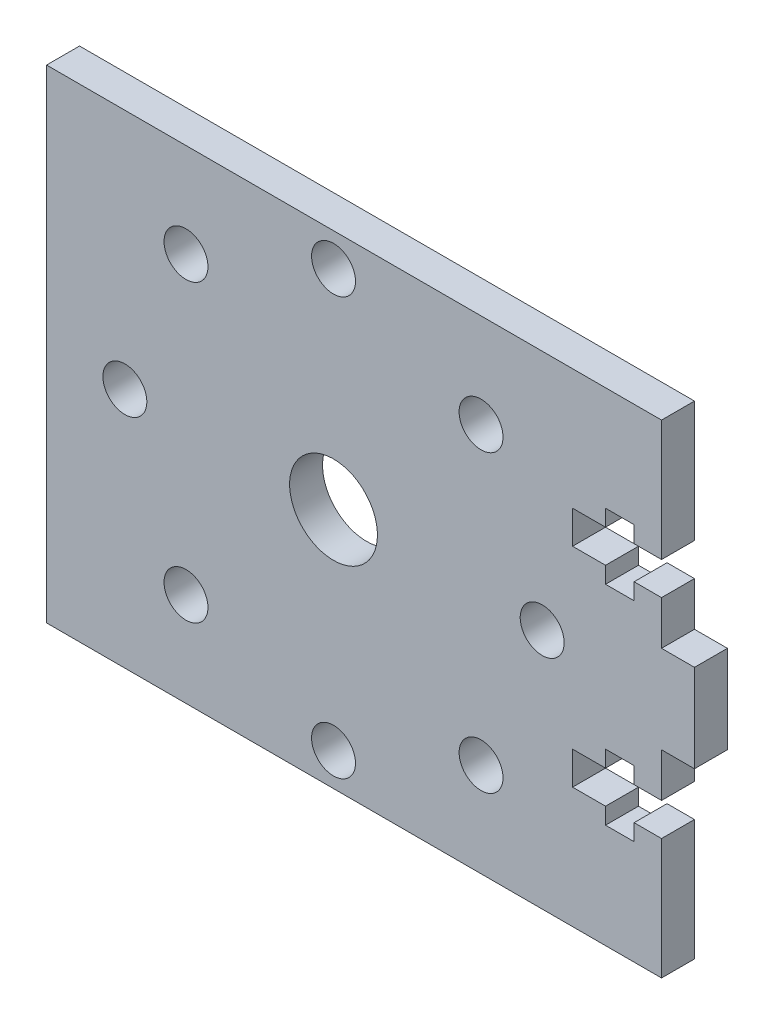
from build123d import *

# Parameters (mm, degrees)
SKETCH_1_R      = 4
SKETCH_1_R_2    = 2
EXTRUDE_1_DEPTH = 3


with BuildPart() as part:
    # 草图1 → 凸台-拉伸1 (new body)
    with BuildSketch(Plane.XY):
        Polygon((27.370057685, 11), (27.370057685, 12.5), (24.770057685, 12.5), (24.770057685, 11), (21.770057685, 11), (21.770057685, 8), (24.770057685, 8), (24.770057685, 6.5), (27.370057685, 6.5), (27.370057685, 8), (29.870057685, 8), (29.870057685, 4), (32.870057685, 4), (32.870057685, 0), (32.870057685, -4), (29.870057685, -4), (29.870057685, -8), (27.370057685, -8), (27.370057685, -6.5), (24.770057685, -6.5), (24.770057685, -8), (21.770057685, -8), (21.770057685, -11), (24.770057685, -11), (24.770057685, -12.5), (27.370057685, -12.5), (27.370057685, -11), (29.870057685, -11), (29.870057685, -22), (-26.129942315, -22), (-26.129942315, 22), (29.870057685, 22), (29.870057685, 11), align=None)
        Circle(SKETCH_1_R, mode=Mode.SUBTRACT)
        with Locations((0, -19)):
            Circle(SKETCH_1_R_2, mode=Mode.SUBTRACT)
        with Locations((-13.435028843, -13.435028843)):
            Circle(SKETCH_1_R_2, mode=Mode.SUBTRACT)
        with Locations((-19, 0)):
            Circle(SKETCH_1_R_2, mode=Mode.SUBTRACT)
        with Locations((-13.435028843, 13.435028843)):
            Circle(SKETCH_1_R_2, mode=Mode.SUBTRACT)
        with Locations((0, 19)):
            Circle(SKETCH_1_R_2, mode=Mode.SUBTRACT)
        with Locations((13.435028843, 13.435028843)):
            Circle(SKETCH_1_R_2, mode=Mode.SUBTRACT)
        with Locations((19, 0)):
            Circle(SKETCH_1_R_2, mode=Mode.SUBTRACT)
        with Locations((13.435028843, -13.435028843)):
            Circle(SKETCH_1_R_2, mode=Mode.SUBTRACT)
    extrude(amount=EXTRUDE_1_DEPTH)


solid = part.part
